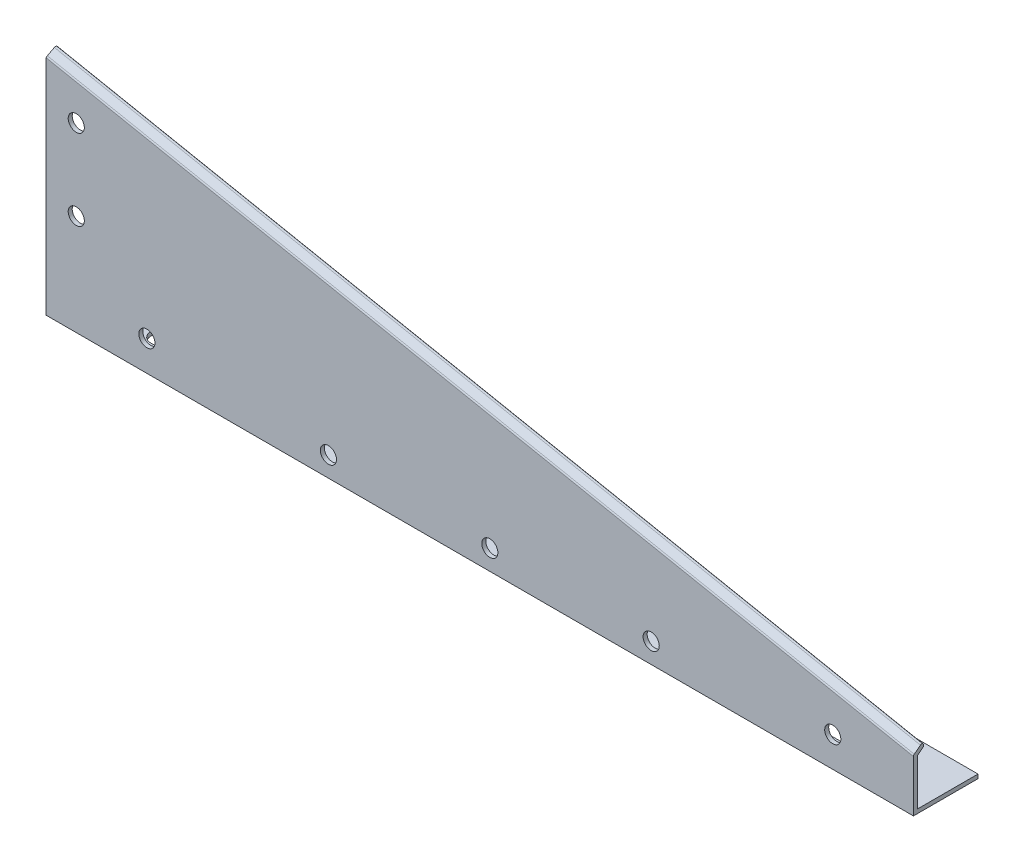
from build123d import *

# Parameters (mm, degrees)
BOSS_EXTRUDE1_DEPTH = 2
SKETCH3_W           = 430
SKETCH3_H           = 2
BOSS_EXTRUDE2_DEPTH = 30
CUT_EXTRUDE1_DEPTH  = 50
SKETCH7_R           = 4
CUT_EXTRUDE2_DEPTH  = 445.998876403
SKETCH8_R           = 4
CUT_EXTRUDE3_DEPTH  = 445.998876403
BOSS_EXTRUDE4_REACH = 466.157
FILLET3_R           = 1


with BuildPart() as part:
    # Sketch2 → Boss-Extrude1 (new body)
    with BuildSketch(Plane.XY):
        Polygon((0, 0), (430, 0), (430, 25), (0, 110), align=None)
    extrude(amount=BOSS_EXTRUDE1_DEPTH)

    # Sketch3 → Boss-Extrude2 (add)
    with BuildSketch(Plane(origin=(0, 0, 0), x_dir=(-1, 0, 0), z_dir=(0, 0, -1))):
        with Locations((-215, 1)):
            Rectangle(SKETCH3_W, SKETCH3_H)
    extrude(amount=BOSS_EXTRUDE2_DEPTH)

    # Sketch4 → Cut-Extrude1 (cut)
    with BuildSketch(Plane(origin=(0, 2, 0), x_dir=(1, 0, 0), z_dir=(0, 1, 0))):
        with BuildLine():
            Line((40, 20), (120, 20))
            ThreePointArc((120, 20), (125, 15), (120, 10))
            Line((120, 10), (40, 10))
            ThreePointArc((40, 10), (35, 15), (40, 20))
        make_face()
        with BuildLine():
            Line((390, 20), (310, 20))
            ThreePointArc((310, 20), (305, 15), (310, 10))
            Line((310, 10), (390, 10))
            ThreePointArc((390, 10), (395, 15), (390, 20))
        make_face()
    extrude(amount=-CUT_EXTRUDE1_DEPTH, mode=Mode.SUBTRACT)

    # Sketch7 → Cut-Extrude2 (cut, through all)
    with BuildSketch(Plane.XY.offset(2)):
        with Locations((15, 50)):
            Circle(SKETCH7_R)
        with Locations((50, 15)):
            Circle(SKETCH7_R)
        with Locations((390, 15)):
            Circle(SKETCH7_R)
        with Locations((15, 90)):
            Circle(SKETCH7_R)
    extrude(amount=-CUT_EXTRUDE2_DEPTH, mode=Mode.SUBTRACT)

    # Sketch8 → Cut-Extrude3 (cut, through all)
    with BuildSketch(Plane.XY.offset(2)):
        with Locations((140, 10)):
            Circle(SKETCH8_R)
        with Locations((220, 10)):
            Circle(SKETCH8_R)
        with Locations((300, 10)):
            Circle(SKETCH8_R)
    extrude(amount=-CUT_EXTRUDE3_DEPTH, mode=Mode.SUBTRACT)

    # Boss-Extrude4: up to this plane
    boss_extrude4_end = Plane(origin=(430, 0, 2), z_dir=(-1, 0, 0))
    # Sketch12 → Boss-Extrude4 (add, up to the surface)
    with BuildSketch(Plane(origin=(-20.926480156, 4.136629798, 0), x_dir=(0, 0, -1), z_dir=(0.9810169593645325, -0.19392195708368665, 0)), mode=Mode.PRIVATE) as boss_extrude4_sk1:
        with BuildLine():
            Line((2.668468057, 109.913216573), (0, 107.91186553))
            Line((0, 107.91186553), (-2, 107.91186553))
            Line((-2, 107.91186553), (-2, 108.91186553))
            Line((-2, 108.91186553), (1.468468057, 111.513216573))
            ThreePointArc((1.468468057, 111.513216573), (2.868468057, 111.313216573), (2.668468057, 109.913216573))
        make_face()
    boss_extrude4_tool1 = split(extrude(boss_extrude4_sk1.sketch, amount=BOSS_EXTRUDE4_REACH, mode=Mode.PRIVATE), bisect_by=boss_extrude4_end, keep=Keep.BOTH, mode=Mode.PRIVATE)
    add(boss_extrude4_tool1.solids().sort_by_distance((0.341058, 111.725355, -0.613229))[0])

    # Fillet3
    fillet3_edges = [part.edges().sort_by_distance(p)[0] for p in [
        (215.096960979, 68.500183664, 2),
        (215, 67.5, 0),
    ]]
    fillet(fillet3_edges, radius=FILLET3_R)


solid = part.part
